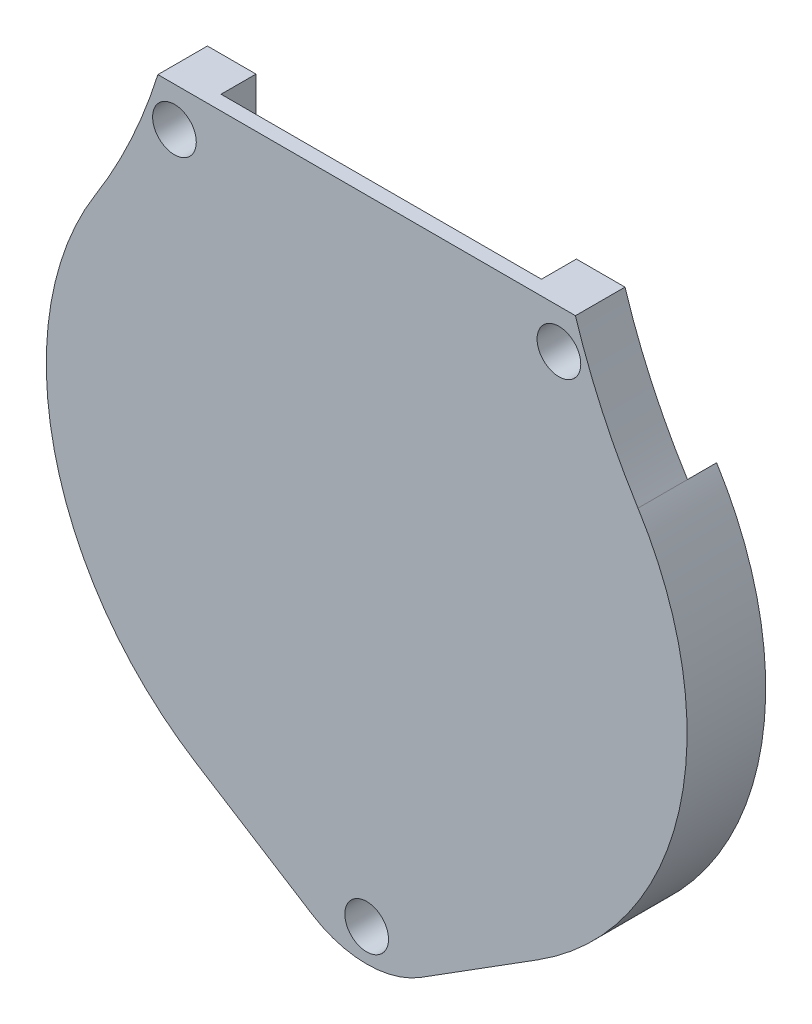
from build123d import *

# Parameters (mm, degrees)
BOSS_EXTRUDE1_DEPTH = 6.858
CUT_EXTRUDE1_DEPTH  = 6.35
SKETCH3_W           = 27.94
SKETCH3_H           = 25.845942769
CUT_EXTRUDE2_DEPTH  = 5.588
SKETCH4_R           = 1.905
CUT_EXTRUDE3_DEPTH  = 3.175
SKETCH5_R           = 1.143
CUT_EXTRUDE4_DEPTH  = 21.59
CUT_EXTRUDE5_DEPTH  = 2.54


with BuildPart() as part:
    # Sketch1 → Boss-Extrude1 (new body)
    with BuildSketch(Plane.XY):
        with BuildLine():
            Line((-4.737825132, -30.035944056), (-14.890307558, -23.641538462))
            ThreePointArc((-14.890307558, -23.641538462), (-27.242520167, -6.203925768), (-23.658870968, 14.862752926))
            ThreePointArc((-23.658870968, 14.862752926), (-20.55370118, 20.591203739), (-18.20732863, 26.67))
            Line((-18.20732863, 26.67), (18.20732863, 26.67))
            ThreePointArc((18.20732863, 26.67), (20.55370118, 20.591203739), (23.658870968, 14.862752926))
            ThreePointArc((23.658870968, 14.862752926), (27.242520167, -6.203925768), (14.890307558, -23.641538462))
            Line((14.890307558, -23.641538462), (4.737825132, -30.035944056))
            ThreePointArc((4.737825132, -30.035944056), (0, -31.403636364), (-4.737825132, -30.035944056))
        make_face()
    extrude(amount=BOSS_EXTRUDE1_DEPTH)

    # Sketch2 → Cut-Extrude1 (cut)
    with BuildSketch(Plane(origin=(0, 0, 0), x_dir=(-1, 0, 0), z_dir=(0, 0, -1))):
        with BuildLine():
            Line((-11.733590414, 23.241), (11.733590414, 23.241))
            ThreePointArc((11.733590414, 23.241), (0, -26.035), (-11.733590414, 23.241))
        make_face()
    extrude(amount=-CUT_EXTRUDE1_DEPTH, mode=Mode.SUBTRACT)

    # Sketch3 → Cut-Extrude2 (cut)
    with BuildSketch(Plane(origin=(0, 0, 0), x_dir=(-1, 0, 0), z_dir=(0, 0, -1))):
        with Locations((0, 24.280777857)):
            Rectangle(SKETCH3_W, SKETCH3_H)
    extrude(amount=-CUT_EXTRUDE2_DEPTH, mode=Mode.SUBTRACT)

    # Sketch4 → Cut-Extrude3 (cut)
    with BuildSketch(Plane.XY.offset(6.858)):
        with Locations((0, -28.575)):
            Circle(SKETCH4_R)
        with Locations((-16.764, 23.241)):
            Circle(SKETCH4_R)
        with Locations((16.764, 23.241)):
            Circle(SKETCH4_R)
    extrude(amount=-CUT_EXTRUDE3_DEPTH, mode=Mode.SUBTRACT)

    # Sketch5 → Cut-Extrude4 (cut)
    with BuildSketch(Plane.XY.offset(3.683)):
        with Locations((-16.764, 23.241)):
            Circle(SKETCH5_R)
        with Locations((16.764, 23.241)):
            Circle(SKETCH5_R)
        with Locations((0, -28.575)):
            Circle(SKETCH5_R)
    extrude(amount=-CUT_EXTRUDE4_DEPTH, mode=Mode.SUBTRACT)

    # Sketch6 → Cut-Extrude5 (cut)
    with BuildSketch(Plane(origin=(0, 0, 0), x_dir=(-1, 0, 0), z_dir=(0, 0, -1))):
        with BuildLine():
            Line((-23.658870968, 14.862752926), (-4.737825132, -30.035944056))
            ThreePointArc((-4.737825132, -30.035944056), (0, -31.403636364), (4.737825132, -30.035944056))
            Line((4.737825132, -30.035944056), (23.658870968, 14.862752926))
            ThreePointArc((23.658870968, 14.862752926), (20.55370118, 20.591203739), (18.20732863, 26.67))
            Line((18.20732863, 26.67), (-18.20732863, 26.67))
            ThreePointArc((-18.20732863, 26.67), (-20.55370118, 20.591203739), (-23.658870968, 14.862752926))
        make_face()
    extrude(amount=-CUT_EXTRUDE5_DEPTH, mode=Mode.SUBTRACT)


solid = part.part
